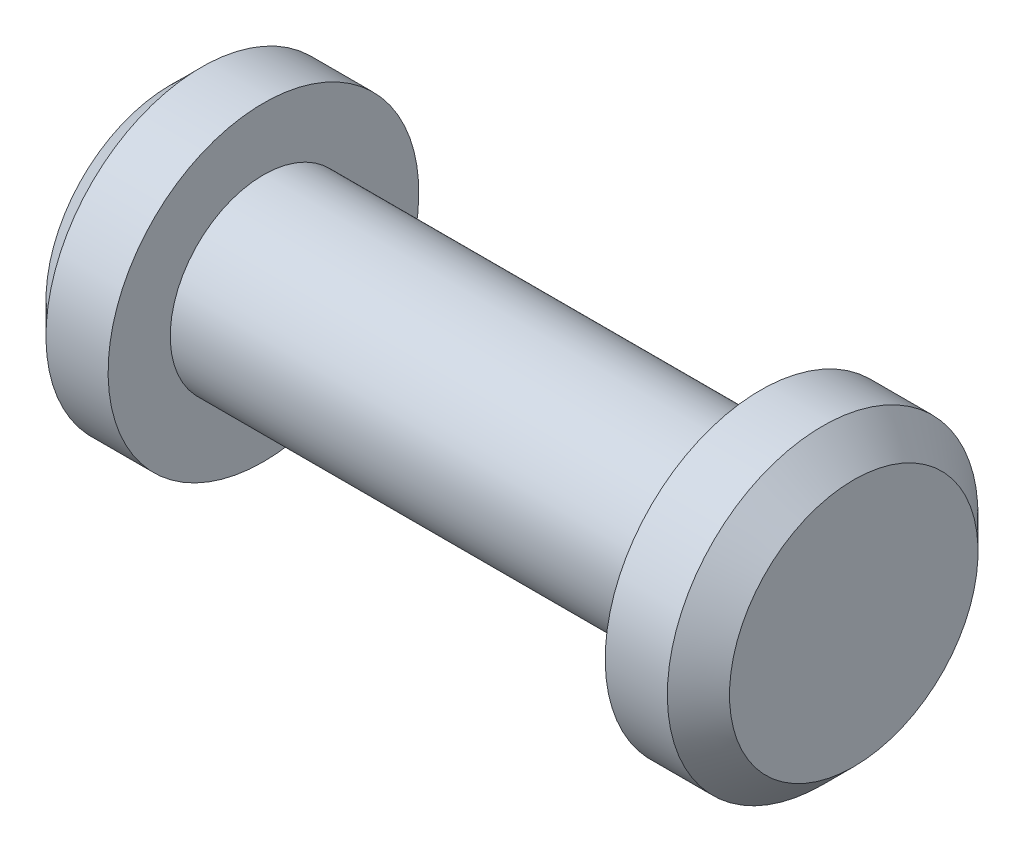
from build123d import *


with BuildPart() as part:
    # Esquisse1 → Révolution1 (revolve)
    with BuildSketch(Plane.XY):
        Polygon((-11, 0), (11, 0), (11, -4), (10, -5), (8, -5), (8, -3), (-8, -3), (-8, -5), (-10, -5), (-11, -4), align=None)
    revolve(axis=Axis((-11, 0, 0), (1, 0, 0)))


solid = part.part
